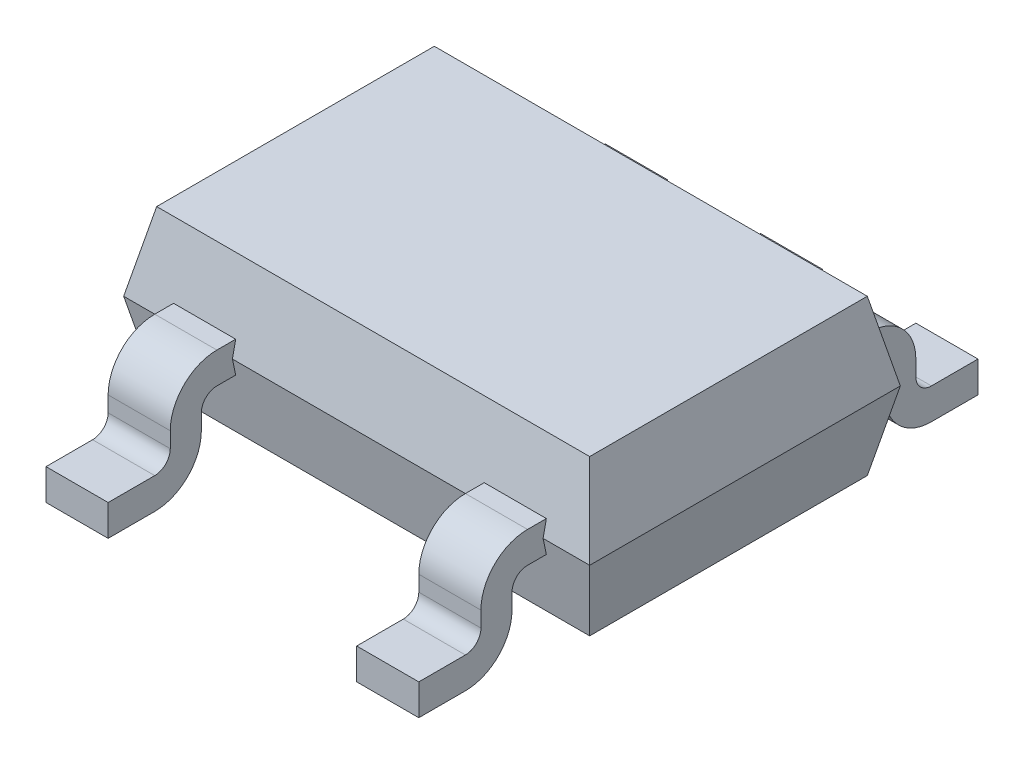
from build123d import *

# Parameters (mm, degrees)
BASES_W               = 3
BASES_H               = 2
BASE_DEPTH            = 0.5
BASE_TAPER            = 12
BASE_OTHER_WAY_DEPTH  = 0.5
BASE_OTHER_WAY_TAPER  = 12
VINSOLDERJOINT_DEPTH  = 0.2
SJLP_COUNT            = 2
SJLP_PITCH            = 1
SJLP_COL_COUNT        = 2
SJLP_COL_PITCH        = 1
VOUTSOLDERJOINT_DEPTH = 0.2


with BuildPart() as part:
    # BaseS → Base (new body)
    with BuildSketch(Plane(origin=(0, 0, 0), x_dir=(1, 0, 0), z_dir=(0, 1, 0))):
        Rectangle(BASES_W, BASES_H)
    extrude(amount=BASE_DEPTH, taper=BASE_TAPER)

    # BaseS → Base other way (add)
    with BuildSketch(Plane(origin=(0, 0, 0), x_dir=(1, 0, 0), z_dir=(0, 1, 0))):
        Rectangle(BASES_W, BASES_H)
    extrude(amount=-BASE_OTHER_WAY_DEPTH, taper=BASE_OTHER_WAY_TAPER)

    # VInSolderJointS → VInSolderJoint (add, symmetric)
    with BuildSketch(Plane(origin=(0, 0, 0), x_dir=(0, 0, -1), z_dir=(1, 0, 0))):
        with BuildLine():
            Line((0.9, -0.1), (1.1, -0.1))
            ThreePointArc((1.1, -0.1), (1.170710678, -0.129289322), (1.2, -0.2))
            Line((1.2, -0.2), (1.2, -0.3))
            ThreePointArc((1.2, -0.3), (1.287867966, -0.512132034), (1.5, -0.6))
            Line((1.5, -0.6), (1.8, -0.6))
            Line((1.8, -0.6), (1.8, -0.4))
            Line((1.8, -0.4), (1.5, -0.4))
            ThreePointArc((1.5, -0.4), (1.429289322, -0.370710678), (1.4, -0.3))
            Line((1.4, -0.3), (1.4, -0.2))
            ThreePointArc((1.4, -0.2), (1.312132034, 0.012132034), (1.1, 0.1))
            Line((1.1, 0.1), (0.9, 0.1))
            Line((0.9, 0.1), (0.9, -0.1))
        make_face()
    vinsolderjoint = extrude(amount=VINSOLDERJOINT_DEPTH, both=True)

    # SJLP: VInSolderJoint ×2
    with Locations(*[(i * SJLP_PITCH, 0, 0) for i in range(1, SJLP_COUNT)]):
        add(vinsolderjoint)

    # SJLP col: VInSolderJoint ×2
    with Locations(*[(-i * SJLP_COL_PITCH, 0, 0) for i in range(1, SJLP_COL_COUNT)]):
        add(vinsolderjoint)

    # VOutSolderJointS → VOutSolderJoint (add, symmetric)
    with BuildSketch(Plane(origin=(1, 0, 0), x_dir=(0, 0, -1), z_dir=(1, 0, 0))):
        with BuildLine():
            Line((-0.9, 0.1), (-1.1, 0.1))
            ThreePointArc((-1.1, 0.1), (-1.312132034, 0.012132034), (-1.4, -0.2))
            Line((-1.4, -0.2), (-1.4, -0.3))
            ThreePointArc((-1.4, -0.3), (-1.429289322, -0.370710678), (-1.5, -0.4))
            Line((-1.5, -0.4), (-1.8, -0.4))
            Line((-1.8, -0.4), (-1.8, -0.6))
            Line((-1.8, -0.6), (-1.5, -0.6))
            ThreePointArc((-1.5, -0.6), (-1.287867966, -0.512132034), (-1.2, -0.3))
            Line((-1.2, -0.3), (-1.2, -0.2))
            ThreePointArc((-1.2, -0.2), (-1.170710678, -0.129289322), (-1.1, -0.1))
            Line((-1.1, -0.1), (-0.9, -0.1))
            Line((-0.9, -0.1), (-0.9, 0.1))
        make_face()
    voutsolderjoint = extrude(amount=VOUTSOLDERJOINT_DEPTH, both=True)

    # VOSJ HM: VOutSolderJoint across plane
    add(voutsolderjoint.mirror(Plane(origin=(0, 0, 0), x_dir=(0, 0, 1), z_dir=(1, 0, 0))))


solid = part.part
